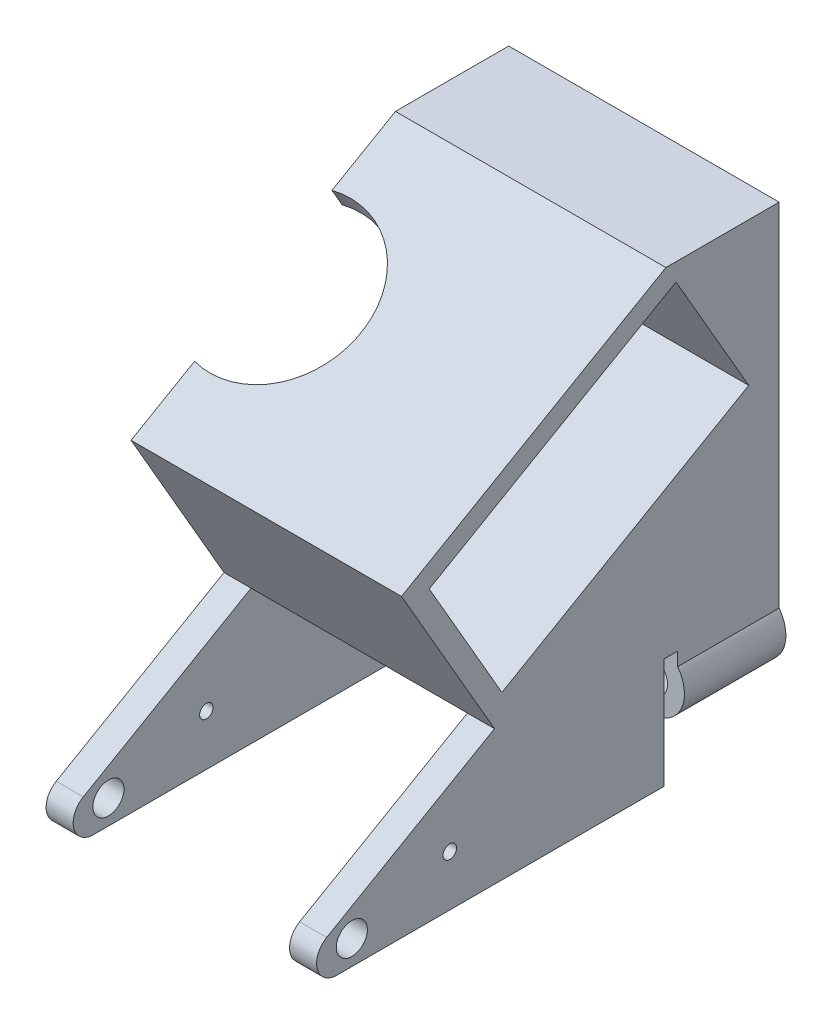
from build123d import *

# Parameters (mm, degrees)
CROQUIS2_R              = 2.5
SALIENTE_EXTRUIR1_DEPTH = 3
SALIENTE_EXTRUIR2_DEPTH = 40
CROQUIS4_R              = 2.5
SALIENTE_EXTRUIR3_DEPTH = 12
CROQUIS6_R              = 2.3
CROQUIS6_R_2            = 1
SALIENTE_EXTRUIR5_DEPTH = 4.000002
SALIENTE_EXTRUIR6_START = -36.000002
CROQUIS6_2_R            = 2.3
CROQUIS6_2_R_2          = 1
SALIENTE_EXTRUIR6_DEPTH = 3.999998
CROQUIS7_R              = 12
CORTAR_EXTRUIR1_DEPTH   = 3


with BuildPart() as part:
    # Croquis2 → Saliente-Extruir1 (new body)
    with BuildSketch(Plane.XY):
        with BuildLine():
            Line((-152.030771759, 47.953613054), (-152.030771759, 99.953613054))
            Line((-152.030771759, 99.953613054), (-112.030771759, 99.953613054))
            Line((-112.030771759, 99.953613054), (-112.030771759, 47.953613054))
            ThreePointArc((-112.030771759, 47.953613054), (-114.449632929, 40.210196563), (-121.030771759, 44.953613054))
            Line((-121.030771759, 44.953613054), (-143.030771759, 44.953613054))
            ThreePointArc((-143.030771759, 44.953613054), (-149.611910589, 40.210196563), (-152.030771759, 47.953613054))
        make_face()
        with Locations((-148.030771759, 44.953613054)):
            Circle(CROQUIS2_R, mode=Mode.SUBTRACT)
        with Locations((-116.030771759, 44.953613054)):
            Circle(CROQUIS2_R, mode=Mode.SUBTRACT)
    extrude(amount=SALIENTE_EXTRUIR1_DEPTH)

    # Croquis3 → Saliente-Extruir2 (add)
    with BuildSketch(Plane.ZY.offset(152.030771759)):
        Polygon((3, 99.953613054), (16.75, 99.953613054), (55.851046981, 77.378613054), (42.101046981, 53.56291445), (3, 76.13791445), align=None)
        Polygon((15.25, 97.355536842), (4.5, 78.735990661), (41.00297077, 57.660990661), (51.75297077, 76.280536842), align=None, mode=Mode.SUBTRACT)
    extrude(amount=-SALIENTE_EXTRUIR2_DEPTH)

    # Croquis4 → Saliente-Extruir3 (add)
    # profile 1 of 2: a face of its own
    with BuildSketch(Plane.XY.offset(3)):
        with BuildLine():
            Line((-152.030771759, 47.953613054), (-152.030771759, 49.953613054))
            Line((-152.030771759, 49.953613054), (-148.030771759, 49.953613054))
            ThreePointArc((-148.030771759, 49.953613054), (-145.794703781, 40.481477099), (-152.030771759, 47.953613054))
        make_face()
        with Locations((-148.030771759, 44.953613054)):
            Circle(CROQUIS4_R, mode=Mode.SUBTRACT)
    # profile 2 of 2: a face of its own
    with BuildSketch(Plane.XY.offset(3)):
        with BuildLine():
            Line((-112.030771759, 49.953613054), (-112.030771759, 47.953613054))
            ThreePointArc((-112.030771759, 47.953613054), (-118.266839736, 40.481477099), (-116.030771759, 49.953613054))
            Line((-116.030771759, 49.953613054), (-112.030771759, 49.953613054))
        make_face()
        with Locations((-116.030771759, 44.953613054)):
            Circle(CROQUIS4_R, mode=Mode.SUBTRACT)
    extrude(amount=SALIENTE_EXTRUIR3_DEPTH)

    # Croquis6 → Saliente-Extruir5 (add)
    with BuildSketch(Plane.ZY.offset(152.030771759)):
        with BuildLine():
            Line((3, 49.953613054), (3, 76.13791445))
            Line((3, 76.13791445), (66.916006899, 39.235990661))
            ThreePointArc((66.916006899, 39.235990661), (68.313784378, 35.861457314), (65.416006899, 33.63791445))
            Line((65.416006899, 33.63791445), (17, 33.63791445))
            Line((17, 33.63791445), (17, 49.953613054))
            Line((17, 49.953613054), (3, 49.953613054))
        make_face()
        with Locations((63.194377499, 37.233198253)):
            Circle(CROQUIS6_R, mode=Mode.SUBTRACT)
        with Locations((48.705490104, 41.11548393)):
            Circle(CROQUIS6_R_2, mode=Mode.SUBTRACT)
    extrude(amount=-SALIENTE_EXTRUIR5_DEPTH)

    # Croquis6<2> → Saliente-Extruir6 (add)
    with BuildSketch(Plane.ZY.offset(152.030771759).offset(SALIENTE_EXTRUIR6_START)):
        with BuildLine():
            Line((3, 49.953613054), (3, 76.13791445))
            Line((3, 76.13791445), (66.916006899, 39.235990661))
            ThreePointArc((66.916006899, 39.235990661), (68.313784378, 35.861457314), (65.416006899, 33.63791445))
            Line((65.416006899, 33.63791445), (17, 33.63791445))
            Line((17, 33.63791445), (17, 49.953613054))
            Line((17, 49.953613054), (3, 49.953613054))
        make_face()
        with Locations((63.194377499, 37.233198253)):
            Circle(CROQUIS6_2_R, mode=Mode.SUBTRACT)
        with Locations((48.705490104, 41.11548393)):
            Circle(CROQUIS6_2_R_2, mode=Mode.SUBTRACT)
    extrude(amount=-SALIENTE_EXTRUIR6_DEPTH)

    # Croquis7 → Cortar-Extruir1 (cut)
    with BuildSketch(Plane(origin=(0, 82.218172547, 47.468684052), x_dir=(1, 0, 0), z_dir=(0, 0.8660254037844388, 0.49999999999999983))):
        with Locations((-149.530771759, 12.895881013)):
            Circle(CROQUIS7_R)
    extrude(amount=-CORTAR_EXTRUIR1_DEPTH, mode=Mode.SUBTRACT)


solid = part.part
